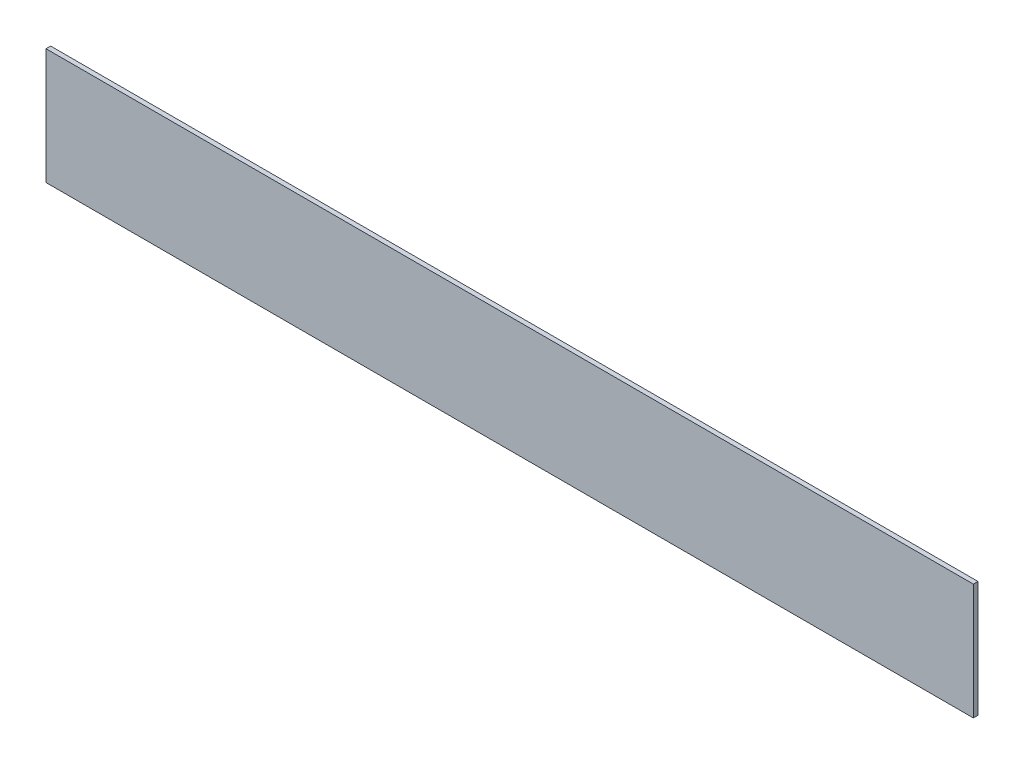
from build123d import *

# Parameters (mm, degrees)
SKETCH1_W             = 320
SKETCH1_H             = 40
KUTU_DUVAR_ON_1_DEPTH = 1.6


with BuildPart() as part:
    # Sketch1 → KUTU_duvar_on_1 (new body)
    with BuildSketch(Plane.XY):
        with Locations((160, 21.6)):
            Rectangle(SKETCH1_W, SKETCH1_H)
    extrude(amount=-KUTU_DUVAR_ON_1_DEPTH)


solid = part.part
